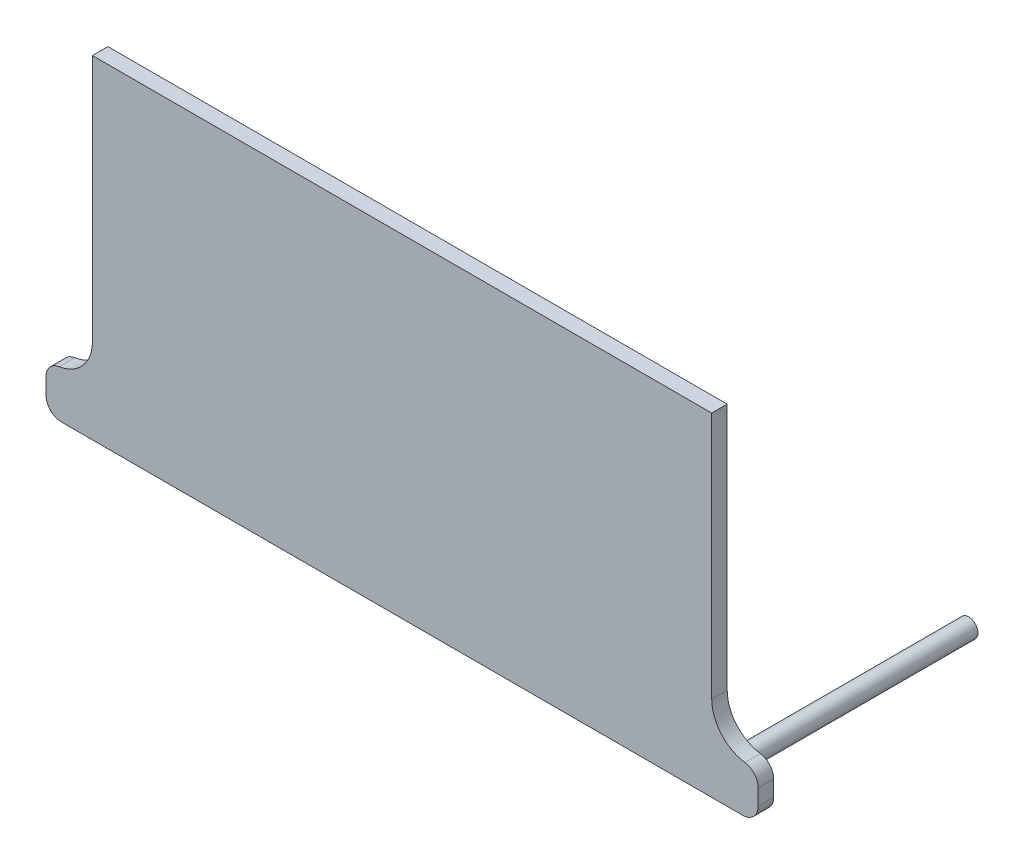
from build123d import *

# Parameters (mm, degrees)
BOSS_EXTRUDE1_DEPTH = 5
FILLET1_R           = 25
SKETCH2_R           = 6
BOSS_EXTRUDE2_DEPTH = 153
FILLET2_R           = 10
FILLET3_R           = 10


with BuildPart() as part:
    # Sketch1 → Boss-Extrude1 (new, symmetric)
    with BuildSketch(Plane.XY):
        Polygon((-200, -107.5), (-230, -107.5), (-230, -77.5), (-200, -77.5), (-200, 107.5), (200, 107.5), (200, -77.5), (230, -77.5), (230, -107.5), (200, -107.5), align=None)
    extrude(amount=BOSS_EXTRUDE1_DEPTH, both=True)

    # Fillet1
    fillet1_edges = [part.edges().sort_by_distance(p)[0] for p in [
        (-200, -77.5, 0),
        (200, -77.5, 0),
    ]]
    fillet(fillet1_edges, radius=FILLET1_R)

    # Sketch2 → Boss-Extrude2 (add)
    with BuildSketch(Plane(origin=(0, 0, -5), x_dir=(-1, 0, 0), z_dir=(0, 0, -1))):
        with Locations(Location((-203, -92.5, 0), (0, 0, 180))):
            Circle(SKETCH2_R)
        with Locations(Location((203, -92.5, 0), (0, 0, 180))):
            Circle(SKETCH2_R)
    extrude(amount=BOSS_EXTRUDE2_DEPTH)

    # Fillet2
    fillet2_edges = [part.edges().sort_by_distance(p)[0] for p in [
        (-230, -107.5, 0),
        (230, -107.5, 0),
        (197, -92.5, -5),
        (-209, -92.5, -5),
    ]]
    fillet(fillet2_edges, radius=FILLET2_R)

    # Fillet3
    fillet3_edges = [part.edges().sort_by_distance(p)[0] for p in [
        (-230, -77.5, 0),
        (230, -77.5, 0),
    ]]
    fillet(fillet3_edges, radius=FILLET3_R)


solid = part.part
